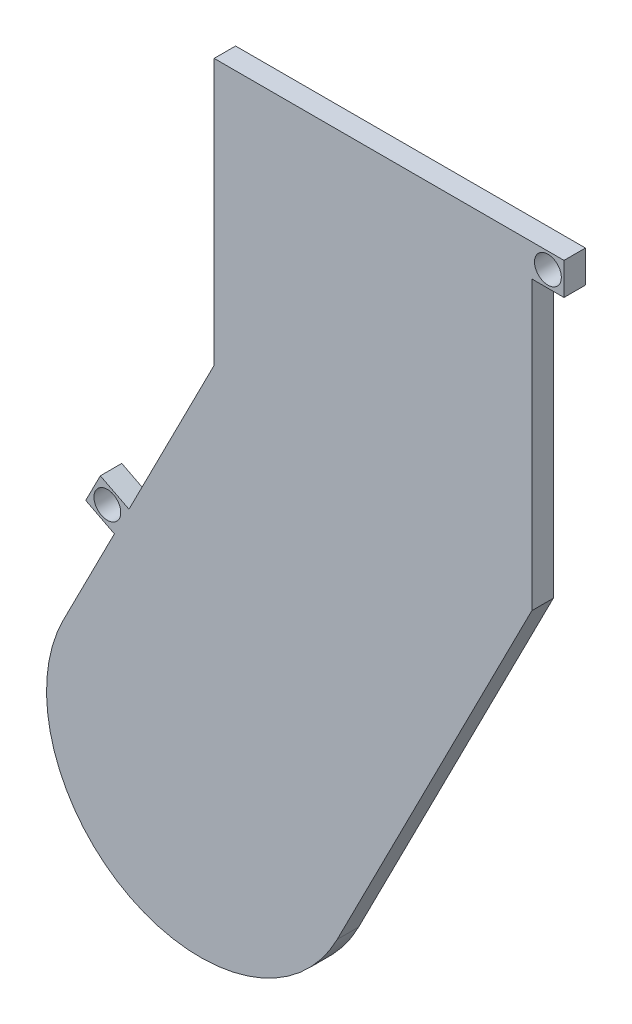
from build123d import *

# Parameters (mm, degrees)
SKETCH2_R           = 3.175
BOSS_EXTRUDE1_DEPTH = 5.08


with BuildPart() as part:
    # Sketch2 → Boss-Extrude1 (new body)
    with BuildSketch(Plane.XY):
        with BuildLine():
            Line((-95.458507722, -102.59724), (-102.247977436, -99.137832392))
            Line((-102.247977436, -99.137832392), (-105.707385044, -105.927302106))
            Line((-105.707385044, -105.927302106), (-98.91791533, -109.386709714))
            Line((-98.91791533, -109.386709714), (-111.025841958, -133.149853715))
            ThreePointArc((-111.025841958, -133.149853715), (-95.109842937, -182.134261878), (-46.125434774, -166.218262858))
            Line((-46.125434774, -166.218262858), (0, -75.692))
            Line((0, -75.692), (0, -7.62))
            Line((0, -7.62), (7.62, -7.62))
            Line((7.62, -7.62), (7.62, 0))
            Line((7.62, 0), (0, 0))
            Line((0, 0), (-75.278630008, 0))
            Line((-75.278630008, 0), (-75.278630008, -62.992))
            Line((-75.278630008, -62.992), (-95.458507722, -102.59724))
        make_face()
        with Locations((3.81, -3.81)):
            Circle(SKETCH2_R, mode=Mode.SUBTRACT)
        with Locations((-100.582946383, -104.262271053)):
            Circle(SKETCH2_R, mode=Mode.SUBTRACT)
    extrude(amount=BOSS_EXTRUDE1_DEPTH)


solid = part.part
